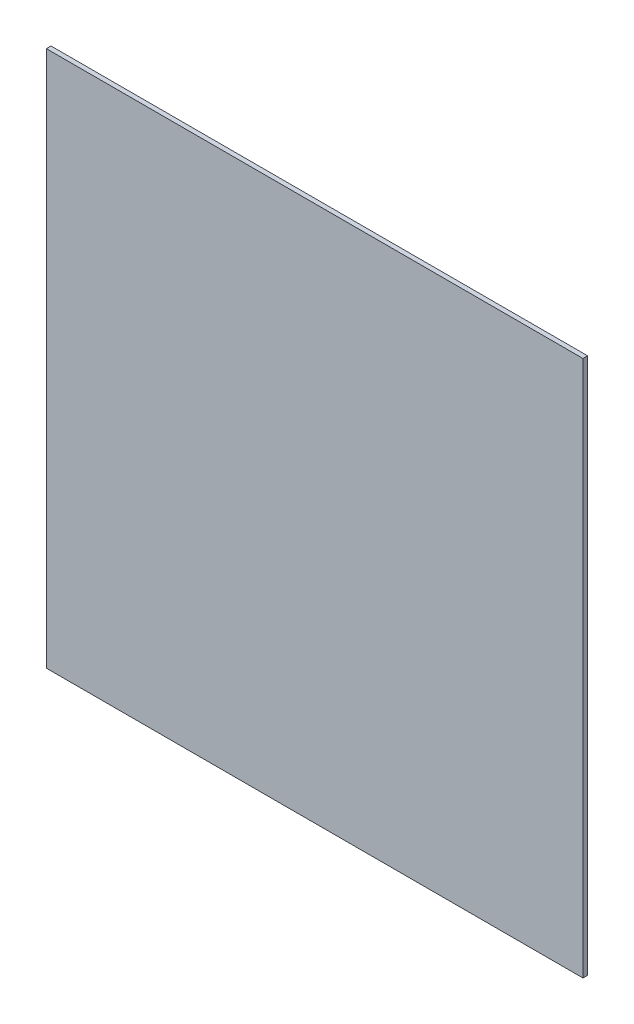
from build123d import *

# Parameters (mm, degrees)
SKETCH1_W           = 127.3
SKETCH1_H           = 127.3
BOSS_EXTRUDE1_DEPTH = 1.1


with BuildPart() as part:
    # Sketch1 → Boss-Extrude1 (new body)
    with BuildSketch(Plane.XY):
        with Locations((0, 63.65)):
            Rectangle(SKETCH1_W, SKETCH1_H)
    extrude(amount=BOSS_EXTRUDE1_DEPTH)


solid = part.part
